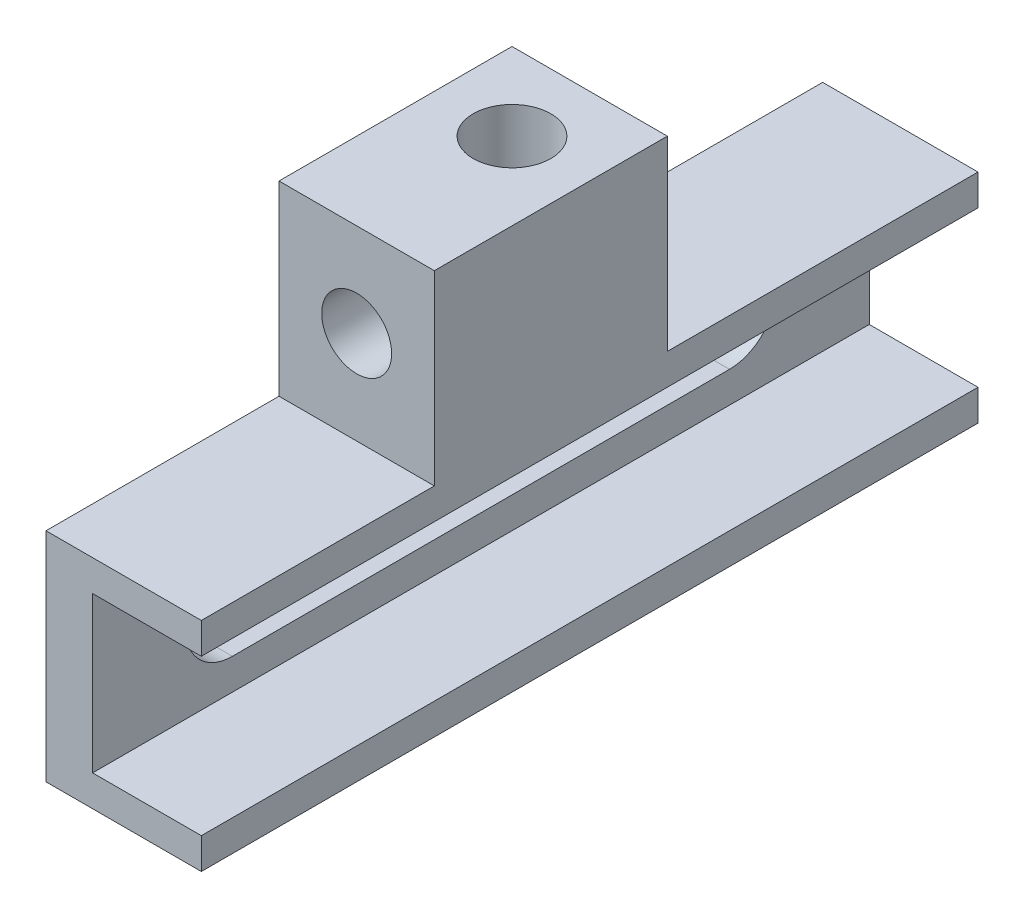
from build123d import *

# Parameters (mm, degrees)
BOSS_EXTRUDE1_DEPTH       = 50
SKETCH2_W                 = 15
SKETCH2_H                 = 12
SKETCH2_W_2               = 20
CUT_EXTRUDE1_DEPTH        = 50
CUT_EXTRUDE2_DEPTH        = 50
F_5_0MM_DOWEL_HOLE1_D     = 5
F_5_0MM_DOWEL_HOLE1_DEPTH = 10
F_5_0MM_DOWEL_HOLE1_TIP   = 1.502151548
SKETCH7_R                 = 2.25
CUT_EXTRUDE3_DEPTH        = 10


with BuildPart() as part:
    # Sketch1 → Boss-Extrude1 (new body)
    with BuildSketch(Plane.XY):
        Polygon((-2, -1), (5, -1), (5, 13), (-5, 13), (-5, -13), (5, -13), (5, -11), (-2, -11), align=None)
    extrude(amount=BOSS_EXTRUDE1_DEPTH)

    # Sketch2 → Cut-Extrude1 (cut)
    with BuildSketch(Plane(origin=(5, 0, 0), x_dir=(0, 0, -1), z_dir=(1, 0, 0))):
        with Locations((-42.5, 7)):
            Rectangle(SKETCH2_W, SKETCH2_H)
        with Locations((-10, 7)):
            Rectangle(SKETCH2_W_2, SKETCH2_H)
    extrude(amount=-CUT_EXTRUDE1_DEPTH, mode=Mode.SUBTRACT)

    # Sketch3 → Cut-Extrude2 (cut)
    with BuildSketch(Plane(origin=(-2, 0, 0), x_dir=(0, 0, -1), z_dir=(1, 0, 0))):
        with BuildLine():
            Line((-41, -3), (-9, -3))
            ThreePointArc((-9, -3), (-6, -6), (-9, -9))
            Line((-9, -9), (-41, -9))
            ThreePointArc((-41, -9), (-44, -6), (-41, -3))
        make_face()
    extrude(amount=-CUT_EXTRUDE2_DEPTH, mode=Mode.SUBTRACT)

    # Ø5.0mm Dowel Hole1
    with Locations(Plane(origin=(0, 13, 0), x_dir=(1, 0, 0), z_dir=(0, 1, 0))):
        with Locations((0, -25)):
            Hole(F_5_0MM_DOWEL_HOLE1_D / 2, depth=F_5_0MM_DOWEL_HOLE1_DEPTH)
            with Locations((0, 0, -(F_5_0MM_DOWEL_HOLE1_DEPTH + F_5_0MM_DOWEL_HOLE1_TIP / 2))):  # 118° drill point
                Cone(0, F_5_0MM_DOWEL_HOLE1_D / 2, F_5_0MM_DOWEL_HOLE1_TIP, mode=Mode.SUBTRACT)

    # Sketch7 → Cut-Extrude3 (cut)
    with BuildSketch(Plane.XY.offset(35)):
        with Locations((0, 7)):
            Circle(SKETCH7_R)
    extrude(amount=-CUT_EXTRUDE3_DEPTH, mode=Mode.SUBTRACT)


solid = part.part
